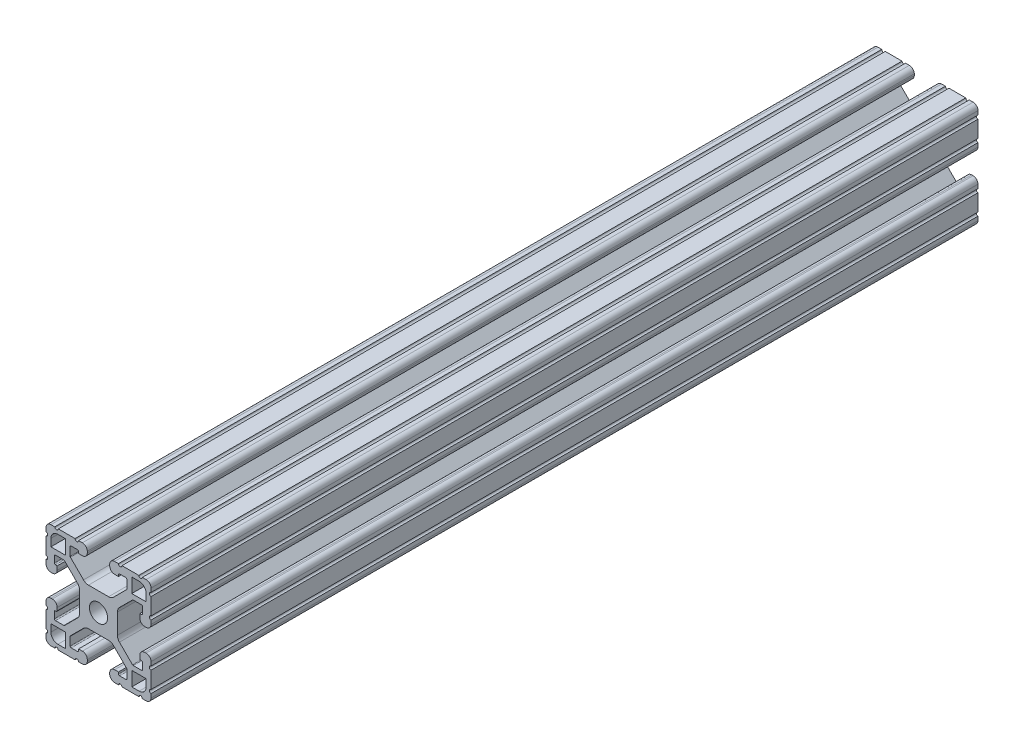
from build123d import *

# Parameters (mm, degrees)
BOSS_EXTRUDE1_DEPTH      = 150.01875
BOSS_EXTRUDE1_DEPTH_BACK = 150.01875
SKETCH3_W                = 38.1
SKETCH3_H                = 38.1
SKETCH4_W                = 5.207
SKETCH4_H                = 5.207
SKETCH4_R                = 3.302
CUT_EXTRUDE1_DEPTH       = 302.244595647
CUT_EXTRUDE2_DEPTH       = 302.244595647
FILLET1_R                = 2.54
FILLET2_R                = 1.778
FILLET3_R                = 0.396875


with BuildPart() as part:
    # Sketch3 → Boss-Extrude1 (new, two sides: drawn at the far end of the back side and taken through both)
    with BuildSketch(Plane.XY.offset(-BOSS_EXTRUDE1_DEPTH_BACK)):
        Rectangle(SKETCH3_W, SKETCH3_H)
    extrude(amount=BOSS_EXTRUDE1_DEPTH + BOSS_EXTRUDE1_DEPTH_BACK)

    # Sketch4 → Cut-Extrude1 (cut, through all)
    with BuildSketch(Plane.XY.offset(150.01875)):
        Polygon((7.239, 14.986), (4.064, 14.986), (4.064, 19.05), (-4.064, 19.05), (-4.064, 14.986), (-7.239, 14.986), (-7.239, 16.002), (-10.287, 16.002), (-10.287, 12.442261469), (-4.702738531, 6.858), (4.702738531, 6.858), (10.287, 12.442261469), (10.287, 16.002), (7.239, 16.002), align=None)
        Polygon((10.287, -12.442261469), (4.702738531, -6.858), (-4.702738531, -6.858), (-10.287, -12.442261469), (-10.287, -16.002), (-7.239, -16.002), (-7.239, -14.986), (-4.064, -14.986), (-4.064, -19.05), (4.064, -19.05), (4.064, -14.986), (7.239, -14.986), (7.239, -16.002), (10.287, -16.002), align=None)
        Polygon((-12.442261469, -10.287), (-6.858, -4.702738531), (-6.858, 4.702738531), (-12.442261469, 10.287), (-16.002, 10.287), (-16.002, 7.239), (-14.986, 7.239), (-14.986, 4.064), (-19.05, 4.064), (-19.05, -4.064), (-14.986, -4.064), (-14.986, -7.239), (-16.002, -7.239), (-16.002, -10.287), align=None)
        Polygon((14.986, -7.239), (14.986, -4.064), (19.05, -4.064), (19.05, 4.064), (14.986, 4.064), (14.986, 7.239), (16.002, 7.239), (16.002, 10.287), (12.442261469, 10.287), (6.858, 4.702738531), (6.858, -4.702738531), (12.442261469, -10.287), (16.002, -10.287), (16.002, -7.239), align=None)
        with Locations((14.6685, 14.6685)):
            Rectangle(SKETCH4_W, SKETCH4_H)
        with Locations((14.6685, -14.6685)):
            Rectangle(SKETCH4_W, SKETCH4_H)
        with Locations((-14.6685, 14.6685)):
            Rectangle(SKETCH4_W, SKETCH4_H)
        with Locations((-14.6685, -14.6685)):
            Rectangle(SKETCH4_W, SKETCH4_H)
        Circle(SKETCH4_R)
    extrude(amount=-CUT_EXTRUDE1_DEPTH, mode=Mode.SUBTRACT)

    # Sketch5 → Cut-Extrude2 (cut, through all)
    with BuildSketch(Plane.XY.offset(150.01875)):
        with BuildLine():
            Line((-14.605, 19.05), (-15.875, 19.05))
            ThreePointArc((-15.875, 19.05), (-15.24, 18.415), (-14.605, 19.05))
        make_face()
        with BuildLine():
            Line((-7.239, 19.05), (-8.509, 19.05))
            ThreePointArc((-8.509, 19.05), (-7.874, 18.415), (-7.239, 19.05))
        make_face()
        with BuildLine():
            ThreePointArc((-19.05, 14.605), (-18.415, 15.24), (-19.05, 15.875))
            Line((-19.05, 15.875), (-19.05, 14.605))
        make_face()
        with BuildLine():
            ThreePointArc((-19.05, 7.239), (-18.415, 7.874), (-19.05, 8.509))
            Line((-19.05, 8.509), (-19.05, 7.239))
        make_face()
        with BuildLine():
            ThreePointArc((7.239, 19.05), (7.874, 18.415), (8.509, 19.05))
            Line((8.509, 19.05), (7.239, 19.05))
        make_face()
        with BuildLine():
            ThreePointArc((14.605, 19.05), (15.24, 18.415), (15.875, 19.05))
            Line((15.875, 19.05), (14.605, 19.05))
        make_face()
        with BuildLine():
            Line((19.05, 14.605), (19.05, 15.875))
            ThreePointArc((19.05, 15.875), (18.415, 15.24), (19.05, 14.605))
        make_face()
        with BuildLine():
            Line((19.05, 7.239), (19.05, 8.509))
            ThreePointArc((19.05, 8.509), (18.415, 7.874), (19.05, 7.239))
        make_face()
        with BuildLine():
            ThreePointArc((19.05, -7.239), (18.415, -7.874), (19.05, -8.509))
            Line((19.05, -8.509), (19.05, -7.239))
        make_face()
        with BuildLine():
            ThreePointArc((19.05, -14.605), (18.415, -15.24), (19.05, -15.875))
            Line((19.05, -15.875), (19.05, -14.605))
        make_face()
        with BuildLine():
            Line((14.605, -19.05), (15.875, -19.05))
            ThreePointArc((15.875, -19.05), (15.24, -18.415), (14.605, -19.05))
        make_face()
        with BuildLine():
            Line((7.239, -19.05), (8.509, -19.05))
            ThreePointArc((8.509, -19.05), (7.874, -18.415), (7.239, -19.05))
        make_face()
        with BuildLine():
            ThreePointArc((-7.239, -19.05), (-7.874, -18.415), (-8.509, -19.05))
            Line((-8.509, -19.05), (-7.239, -19.05))
        make_face()
        with BuildLine():
            ThreePointArc((-14.605, -19.05), (-15.24, -18.415), (-15.875, -19.05))
            Line((-15.875, -19.05), (-14.605, -19.05))
        make_face()
        with BuildLine():
            Line((-19.05, -14.605), (-19.05, -15.875))
            ThreePointArc((-19.05, -15.875), (-18.415, -15.24), (-19.05, -14.605))
        make_face()
        with BuildLine():
            Line((-19.05, -7.239), (-19.05, -8.509))
            ThreePointArc((-19.05, -8.509), (-18.415, -7.874), (-19.05, -7.239))
        make_face()
    extrude(amount=-CUT_EXTRUDE2_DEPTH, mode=Mode.SUBTRACT)

    # Fillet1
    fillet1_edges = [part.edges().sort_by_distance(p)[0] for p in [
        (6.858, -4.702738531, 0),
        (6.858, 4.702738531, 0),
        (-17.272, 17.272, 0),
        (-17.272, -17.272, 0),
        (17.272, -17.272, 0),
        (17.272, 17.272, 0),
        (-4.702738531, -6.858, 0),
        (4.702738531, -6.858, 0),
        (-6.858, 4.702738531, 0),
        (-6.858, -4.702738531, 0),
        (4.702738531, 6.858, 0),
        (-4.702738531, 6.858, 0),
    ]]
    fillet(fillet1_edges, radius=FILLET1_R)

    # Fillet2
    fillet2_edges = [part.edges().sort_by_distance(p)[0] for p in [
        (14.986, 4.064, 0),
        (19.05, 4.064, 0),
        (19.05, -4.064, 0),
        (14.986, -4.064, 0),
        (4.064, -14.986, 0),
        (4.064, -19.05, 0),
        (-4.064, -19.05, 0),
        (-4.064, -14.986, 0),
        (-14.986, -4.064, 0),
        (-19.05, -4.064, 0),
        (-19.05, 4.064, 0),
        (-14.986, 4.064, 0),
        (-19.05, 19.05, 0),
        (19.05, 19.05, 0),
        (19.05, -19.05, 0),
        (-19.05, -19.05, 0),
        (-4.064, 14.986, 0),
        (-4.064, 19.05, 0),
        (4.064, 19.05, 0),
        (4.064, 14.986, 0),
    ]]
    fillet(fillet2_edges, radius=FILLET2_R)

    # Fillet3
    fillet3_edges = [part.edges().sort_by_distance(p)[0] for p in [
        (12.442261469, 10.287, 0),
        (16.002, 10.287, 0),
        (16.002, 7.239, 0),
        (16.002, -7.239, 0),
        (16.002, -10.287, 0),
        (12.442261469, -10.287, 0),
        (-7.239, -16.002, 0),
        (-10.287, -16.002, 0),
        (-10.287, -12.442261469, 0),
        (10.287, -12.442261469, 0),
        (10.287, -16.002, 0),
        (7.239, -16.002, 0),
        (-16.002, 7.239, 0),
        (-16.002, 10.287, 0),
        (-12.442261469, 10.287, 0),
        (-12.442261469, -10.287, 0),
        (-16.002, -10.287, 0),
        (-14.986, -7.239, 0),
        (-10.287, 12.442261469, 0),
        (-10.287, 16.002, 0),
        (-7.239, 16.002, 0),
        (7.239, 16.002, 0),
        (10.287, 16.002, 0),
        (10.287, 12.442261469, 0),
    ]]
    fillet(fillet3_edges, radius=FILLET3_R)


solid = part.part
